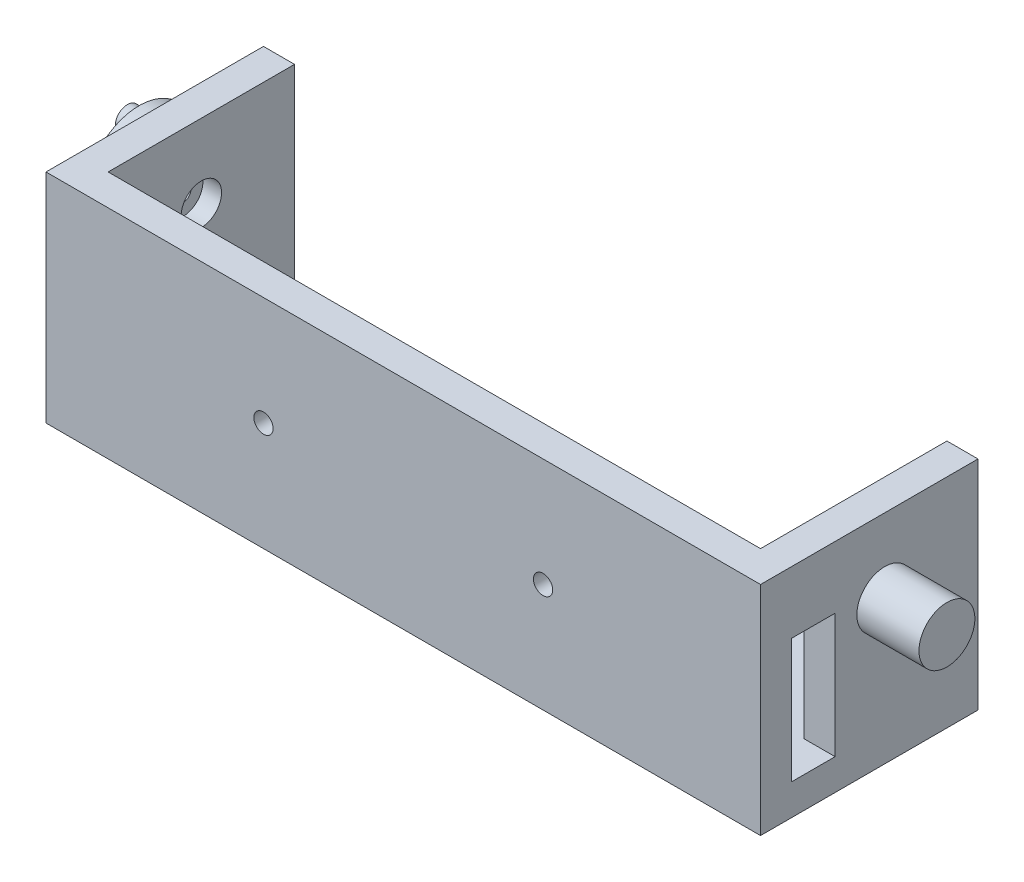
from build123d import *

# Parameters (mm, degrees)
SKETCH1_W           = 115
SKETCH1_H           = 30
BOSS_EXTRUDE1_DEPTH = 5
SKETCH2_W           = 5
SKETCH2_H           = 30
BOSS_EXTRUDE2_DEPTH = 30
SKETCH3_R           = 8.75
BOSS_EXTRUDE3_DEPTH = 5
SKETCH4_R           = 1.95
BOSS_EXTRUDE4_DEPTH = 1.9
CIRPATTERN1_COUNT   = 4
SKETCH5_W           = 115
SKETCH5_H           = 35
BOSS_EXTRUDE5_DEPTH = 5
SKETCH6_R           = 1.55
CUT_EXTRUDE2_DEPTH  = 124.895116934
SKETCH7_R           = 1.35
CUT_EXTRUDE3_DEPTH  = 10
SKETCH8_R           = 3.25
CUT_EXTRUDE4_DEPTH  = 3
SKETCH9_W           = 7
SKETCH9_H           = 20
CUT_EXTRUDE5_DEPTH  = 5
SKETCH10_R          = 4.5
BOSS_EXTRUDE6_DEPTH = 10


with BuildPart() as part:
    # Sketch1 → Boss-Extrude1 (new body)
    with BuildSketch(Plane(origin=(0, 0, 0), x_dir=(1, 0, 0), z_dir=(0, 1, 0))):
        with Locations((57.5, -15)):
            Rectangle(SKETCH1_W, SKETCH1_H)
    extrude(amount=BOSS_EXTRUDE1_DEPTH)

    # Sketch2 → Boss-Extrude2 (add)
    with BuildSketch(Plane(origin=(0, 5, 0), x_dir=(1, 0, 0), z_dir=(0, 1, 0))):
        with Locations((2.5, -15)):
            Rectangle(SKETCH2_W, SKETCH2_H)
        with Locations((112.5, -15)):
            Rectangle(SKETCH2_W, SKETCH2_H)
    extrude(amount=BOSS_EXTRUDE2_DEPTH)

    # Sketch3 → Boss-Extrude3 (add)
    with BuildSketch(Plane.ZY):
        with Locations((15, 23)):
            Circle(SKETCH3_R)
    extrude(amount=BOSS_EXTRUDE3_DEPTH)

    # Sketch4 → Boss-Extrude4 (add)
    with BuildSketch(Plane.ZY.offset(5)):
        with Locations(Location((15, 29, 0), (0, 0, 180))):
            Circle(SKETCH4_R)
    boss_extrude4 = extrude(amount=BOSS_EXTRUDE4_DEPTH)

    # CirPattern1: Boss-Extrude4 ×4 about axis
    cirpattern1_axis = Axis((0, 23, 15), (1, 0, 0))
    for i in range(1, CIRPATTERN1_COUNT):
        add(boss_extrude4.rotate(cirpattern1_axis, i * 360 / CIRPATTERN1_COUNT))

    # Sketch5 → Boss-Extrude5 (add)
    with BuildSketch(Plane.XY.offset(30)):
        with Locations((57.5, 17.5)):
            Rectangle(SKETCH5_W, SKETCH5_H)
    extrude(amount=BOSS_EXTRUDE5_DEPTH)

    # Sketch6 → Cut-Extrude2 (cut, through all)
    with BuildSketch(Plane(origin=(0, 0, 30), x_dir=(-1, 0, 0), z_dir=(0, 0, -1))):
        with Locations((-80, 17.5)):
            Circle(SKETCH6_R)
        with Locations((-35, 17.5)):
            Circle(SKETCH6_R)
    extrude(amount=-CUT_EXTRUDE2_DEPTH, mode=Mode.SUBTRACT)

    # Sketch7 → Cut-Extrude3 (cut)
    with BuildSketch(Plane.ZY.offset(5)):
        with Locations((15, 23)):
            Circle(SKETCH7_R)
    extrude(amount=-CUT_EXTRUDE3_DEPTH, mode=Mode.SUBTRACT)

    # Sketch8 → Cut-Extrude4 (cut)
    with BuildSketch(Plane(origin=(5, 0, 0), x_dir=(0, 0, -1), z_dir=(1, 0, 0))):
        with Locations((-15, 23)):
            Circle(SKETCH8_R)
    extrude(amount=-CUT_EXTRUDE4_DEPTH, mode=Mode.SUBTRACT)

    # Sketch9 → Cut-Extrude5 (cut)
    with BuildSketch(Plane(origin=(115, 0, 0), x_dir=(0, 0, -1), z_dir=(1, 0, 0))):
        with Locations((-26.5, 15)):
            Rectangle(SKETCH9_W, SKETCH9_H)
    extrude(amount=-CUT_EXTRUDE5_DEPTH, mode=Mode.SUBTRACT)

    # Sketch10 → Boss-Extrude6 (add)
    with BuildSketch(Plane(origin=(115, 0, 0), x_dir=(0, 0, -1), z_dir=(1, 0, 0))):
        with Locations(Location((-15, 23, 0), (0, 0, 180))):
            Circle(SKETCH10_R)
    extrude(amount=BOSS_EXTRUDE6_DEPTH)


solid = part.part
